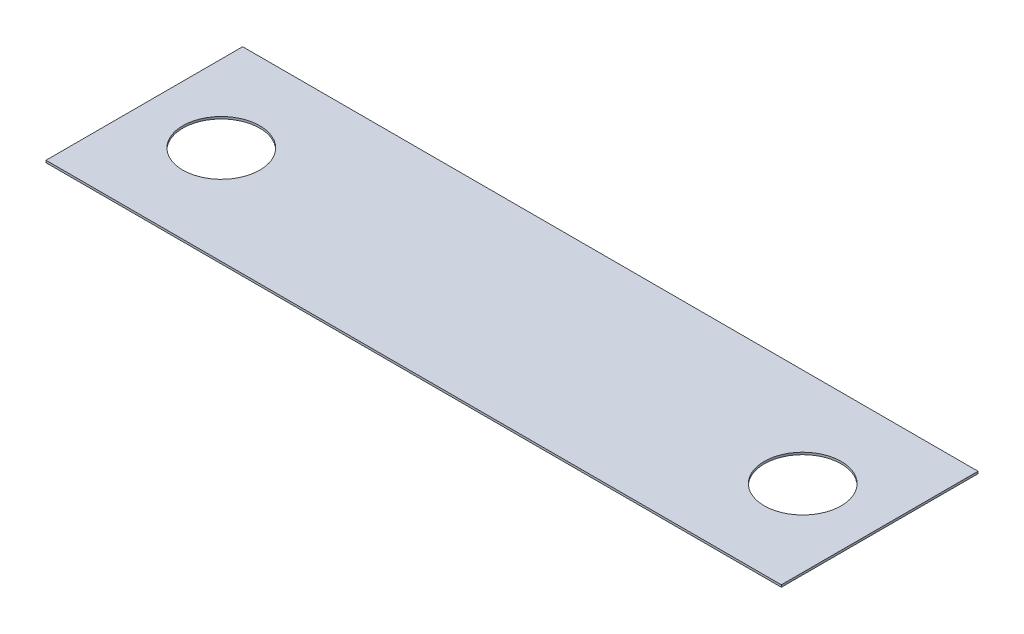
from build123d import *

# Parameters (mm, degrees)
SKETCH1_W                = 86
SKETCH1_H                = 23
EXTRUDE1_DEPTH           = 0.254
F_9_0_9_DIAMETER_HOLE1_D = 9


with BuildPart() as part:
    # Sketch1 → Extrude1 (new body)
    with BuildSketch(Plane(origin=(0, 0, 0), x_dir=(1, 0, 0), z_dir=(0, 1, 0))):
        with Locations((43, 11.5)):
            Rectangle(SKETCH1_W, SKETCH1_H)
    extrude(amount=EXTRUDE1_DEPTH)

    # Ø9.0 (9) Diameter Hole1 (through all)
    with Locations(Plane(origin=(0, 0.254, 0), x_dir=(-1, 0, 0), z_dir=(0, 1, 0))):
        with Locations((-9, -11.5), (-77, -11.5)):
            Hole(F_9_0_9_DIAMETER_HOLE1_D / 2)


solid = part.part
